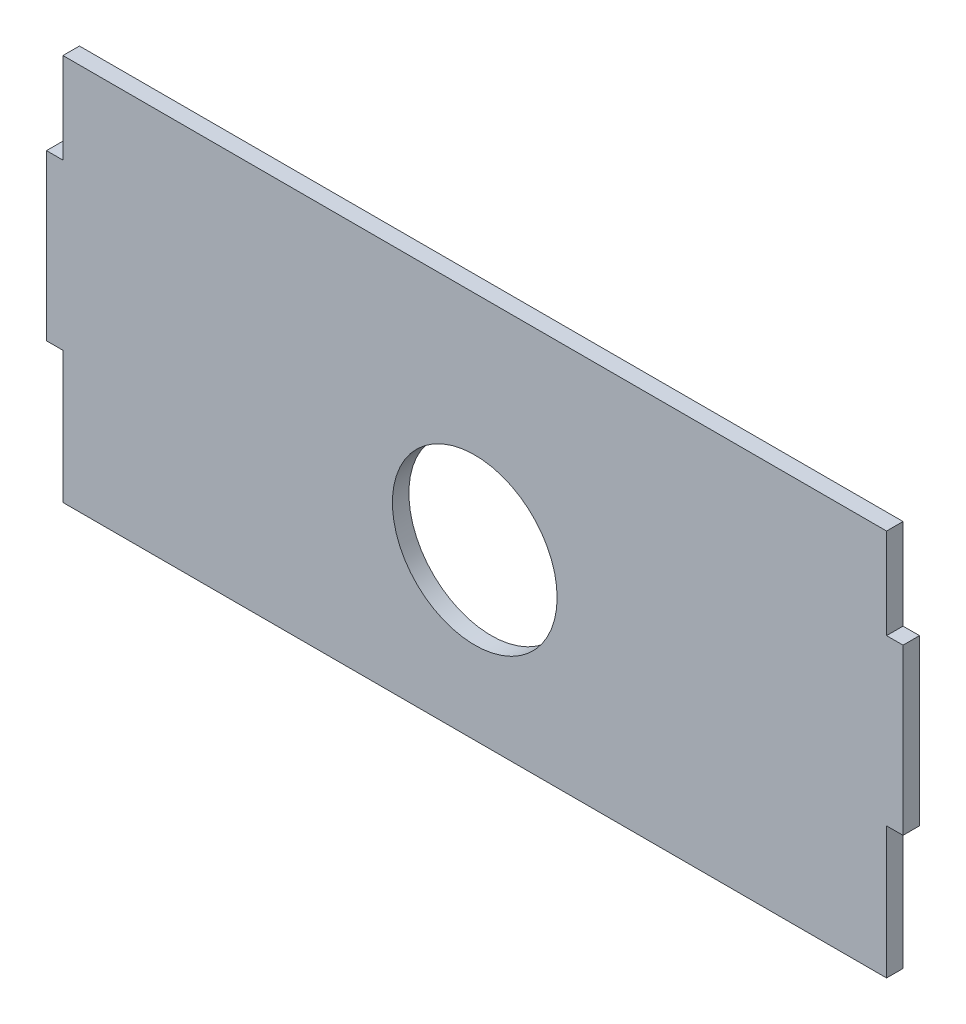
from build123d import *

# Parameters (mm, degrees)
SKETCH_1_W      = 100
SKETCH_1_H      = 47
SKETCH_1_R      = 10
SKETCH_1_W_2    = 2
SKETCH_1_H_2    = 20
EXTRUDE_1_DEPTH = 2


with BuildPart() as part:
    # Эскиз1 → Бобышка-Вытянуть1 (new body)
    # profile 1 of 3: a face of its own
    with BuildSketch(Plane.XY):
        with Locations((50, 23.5)):
            Rectangle(SKETCH_1_W, SKETCH_1_H)
        with Locations((50, 20)):
            Circle(SKETCH_1_R, mode=Mode.SUBTRACT)
    # profile 2 of 3: a face of its own
    with BuildSketch(Plane.XY):
        with Locations((101, 26)):
            Rectangle(SKETCH_1_W_2, SKETCH_1_H_2)
    # profile 3 of 3: a face of its own
    with BuildSketch(Plane.XY):
        with Locations((-1, 26)):
            Rectangle(SKETCH_1_W_2, SKETCH_1_H_2)
    extrude(amount=EXTRUDE_1_DEPTH)


solid = part.part
